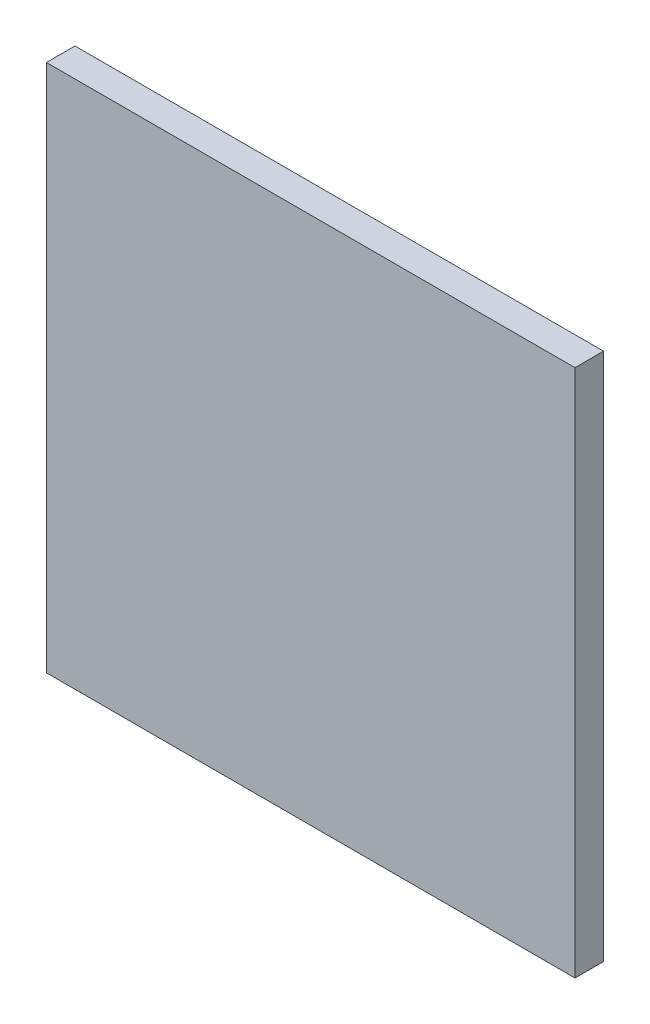
from build123d import *

# Parameters (mm, degrees)
CROQUIS1_W              = 370
CROQUIS1_H              = 370
SALIENTE_EXTRUIR1_DEPTH = 20


with BuildPart() as part:
    # Croquis1 → Saliente-Extruir1 (new body)
    with BuildSketch(Plane.XY):
        with Locations((790.123437975, 509.281976167)):
            Rectangle(CROQUIS1_W, CROQUIS1_H)
    extrude(amount=SALIENTE_EXTRUIR1_DEPTH)


solid = part.part
